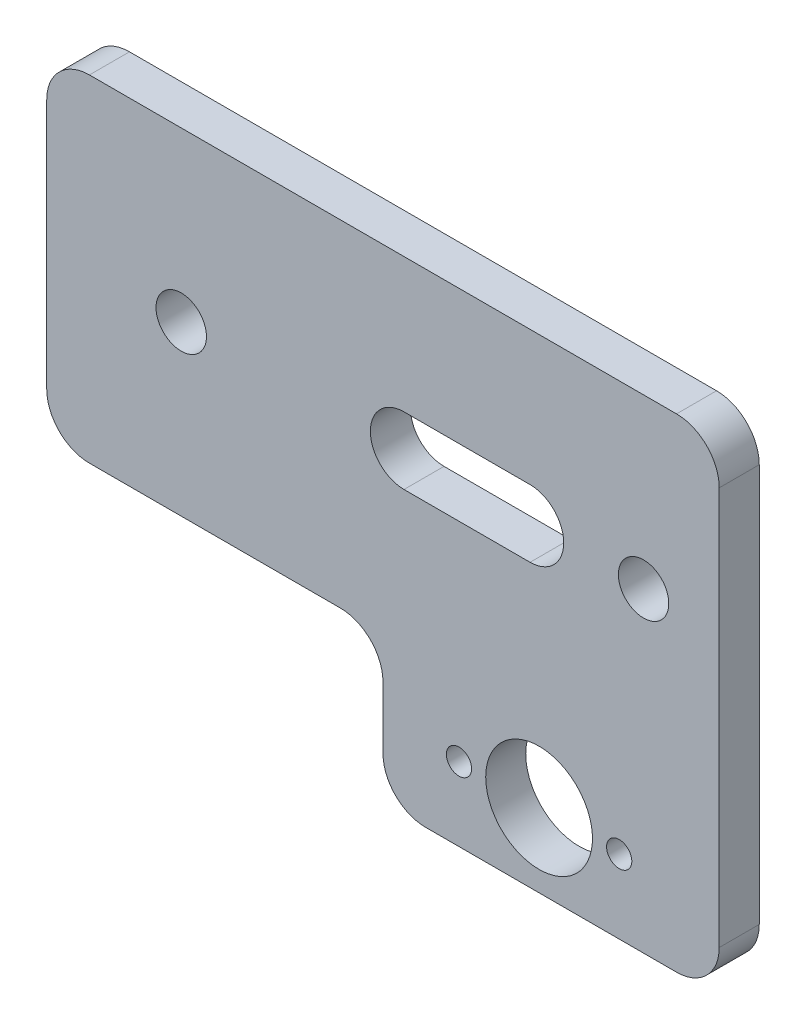
from build123d import *

# Parameters (mm, degrees)
SKETCH1_R                    = 6.349999999
SKETCH1_R_2                  = 3
BOSS_EXTRUDE1_DEPTH          = 4.7625
FILLET1_R                    = 5.08
F_3_0_3_DIAMETER_HOLE1_D     = 3
F_3_0_3_DIAMETER_HOLE1_DEPTH = 25.4
F_3_0_3_DIAMETER_HOLE1_TIP   = 0.901290929


with BuildPart() as part:
    # Sketch1 → Boss-Extrude1 (new body)
    with BuildSketch(Plane.XY):
        Polygon((528.484361343, 22.816913392), (448.484361343, 22.816913392), (448.484361343, -17.183086608), (488.484361343, -17.183086608), (488.484361343, -34.703086608), (528.484361343, -34.703086608), align=None)
        with Locations(Location((507.054361343, -25.943086608, 0), (0, 0, 180))):
            Circle(SKETCH1_R, mode=Mode.SUBTRACT)
        with Locations(Location((464.484361343, 2.816913392, 0), (0, 0, 180))):
            Circle(SKETCH1_R_2, mode=Mode.SUBTRACT)
        with Locations(Location((519.484361343, 2.816913392, 0), (0, 0, 180))):
            Circle(SKETCH1_R_2, mode=Mode.SUBTRACT)
        with BuildLine():
            Line((490.984361343, 6.816913392), (505.984361343, 6.816913392))
            ThreePointArc((505.984361343, 6.816913392), (509.984361343, 2.816913392), (505.984361343, -1.183086608))
            Line((505.984361343, -1.183086608), (490.984361343, -1.183086608))
            ThreePointArc((490.984361343, -1.183086608), (486.984361343, 2.816913392), (490.984361343, 6.816913392))
        make_face(mode=Mode.SUBTRACT)
    extrude(amount=BOSS_EXTRUDE1_DEPTH)

    # Fillet1
    fillet1_edges = [part.edges().sort_by_distance(p)[0] for p in [
        (528.484361343, -34.703086608, 2.38125),
        (488.484361343, -34.703086608, 2.38125),
        (488.484361343, -17.183086608, 2.38125),
        (448.484361343, -17.183086608, 2.38125),
        (448.484361343, 22.816913392, 2.38125),
        (528.484361343, 22.816913392, 2.38125),
    ]]
    fillet(fillet1_edges, radius=FILLET1_R)

    # Ø3.0 (3) Diameter Hole1
    with Locations(Plane(origin=(0, 0, 0), x_dir=(-1, 0, 0), z_dir=(0, 0, -1))):
        with Locations((-497.524361343, -25.943086608), (-516.584361343, -25.943086608)):
            Hole(F_3_0_3_DIAMETER_HOLE1_D / 2, depth=F_3_0_3_DIAMETER_HOLE1_DEPTH)
            with Locations((0, 0, -(F_3_0_3_DIAMETER_HOLE1_DEPTH + F_3_0_3_DIAMETER_HOLE1_TIP / 2))):  # 118° drill point
                Cone(0, F_3_0_3_DIAMETER_HOLE1_D / 2, F_3_0_3_DIAMETER_HOLE1_TIP, mode=Mode.SUBTRACT)


solid = part.part
